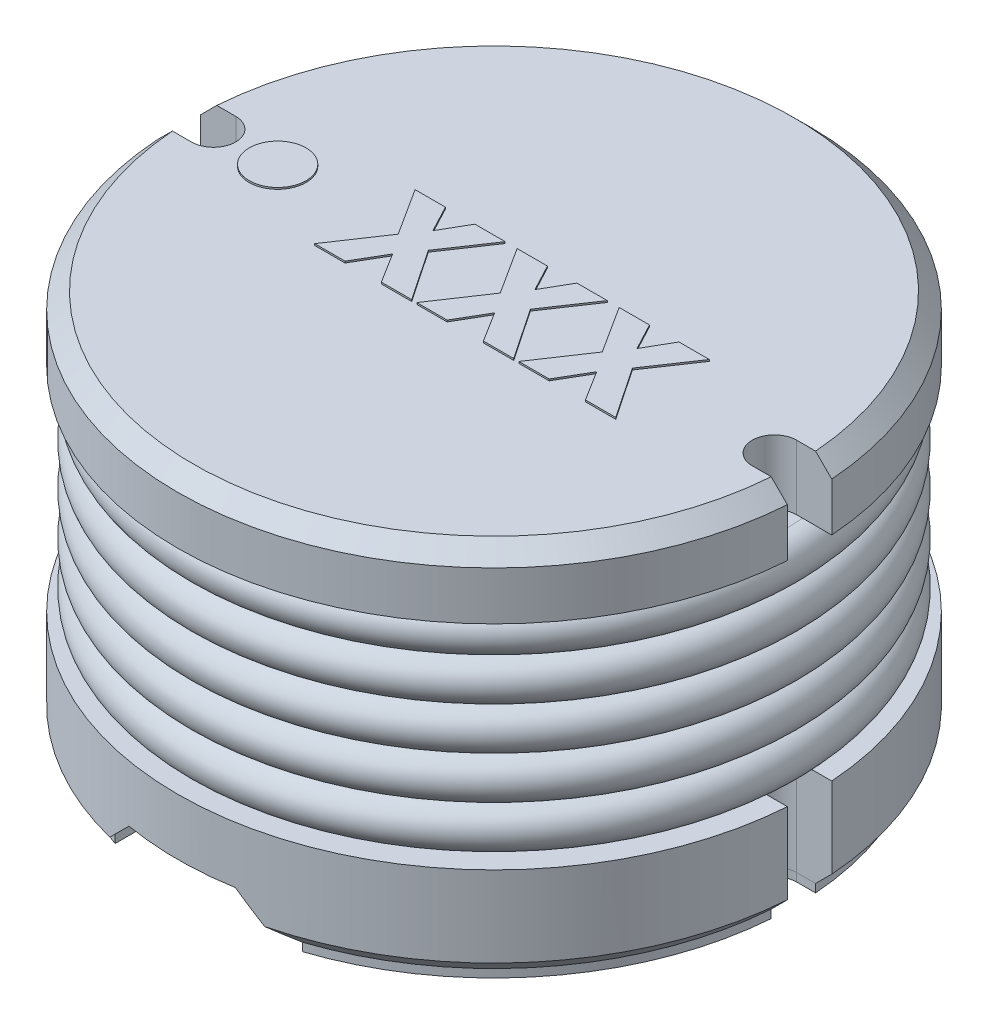
from build123d import *

# Parameters (mm, degrees)
CUTEXTD_BOTTOM_NOTCH_DEPTH            = 10.036592278
CUTEXTD_BOTTOM_NOTCH_DEPTH_BACK       = 10.036592278
CUTEXTD_TOP_BOT_WIRE_PASSTHRUS_DEPTH  = 10.036592278
EXTDBOSS_ELECTRODES_ON_BOTTOM_DEPTH   = 0.127
EXTDBOSS_ELECTRODES_ON_BOTTOM_2_DEPTH = 0.127
SKETCH6_R                             = 0.440109776
BOSSEXTD_LABEL_TOP_DEPTH              = 0.0254
BOSSEXTD_LABEL_TOP_2_DEPTH            = 0.0254
BOSSEXTD_LABEL_TOP_3_DEPTH            = 0.0254
BOSSEXTD_LABEL_TOP_4_DEPTH            = 0.0254


with BuildPart() as part:
    # Sketch1 → Revolve: Main Core Shape (revolve)
    with BuildSketch(Plane.XY, mode=Mode.PRIVATE) as revolve_main_core_shape_sk:
        Polygon((0, 0), (4.65, 0), (4.9, 0.25), (4.9, 1.5), (4, 1.5), (4, 4.8), (4.9, 4.8), (4.9, 5.55), (4.65, 5.8), (0, 5.8), align=None)
    revolve(revolve_main_core_shape_sk.sketch.rotate(Axis((0, -9.075341638, 0), (0, 1, 0)), 90), axis=Axis((0, -9.075341638, 0), (0, 1, 0)))

    # Sketch2 → CutExtd: Bottom Notch (cut, two sides: drawn at the far end of the back side and taken through both)
    with BuildSketch(Plane.XY.offset(-CUTEXTD_BOTTOM_NOTCH_DEPTH_BACK)):
        Polygon((-1.45, 0), (-0.825, 0.625), (0.825, 0.625), (1.45, 0), align=None)
    extrude(amount=CUTEXTD_BOTTOM_NOTCH_DEPTH + CUTEXTD_BOTTOM_NOTCH_DEPTH_BACK, mode=Mode.SUBTRACT)

    # Sketch3 → CutExtd: Top/Bot Wire PassThrus (cut, through all)
    with BuildSketch(Plane(origin=(0, 0, 0), x_dir=(1, 0, 0), z_dir=(0, 1, 0))):
        with BuildLine():
            Line((-5.456343832, 0.343656168), (-4.343656168, 0.343656168))
            ThreePointArc((-4.343656168, 0.343656168), (-4, 0), (-4.343656168, -0.343656168))
            Line((-4.343656168, -0.343656168), (-5.456343832, -0.343656168))
            ThreePointArc((-5.456343832, -0.343656168), (-5.8, 0), (-5.456343832, 0.343656168))
        make_face()
        with BuildLine():
            Line((5.456343832, -0.343656168), (4.343656168, -0.343656168))
            ThreePointArc((4.343656168, -0.343656168), (4, 0), (4.343656168, 0.343656168))
            Line((4.343656168, 0.343656168), (5.456343832, 0.343656168))
            ThreePointArc((5.456343832, 0.343656168), (5.8, 0), (5.456343832, -0.343656168))
        make_face()
    extrude(amount=CUTEXTD_TOP_BOT_WIRE_PASSTHRUS_DEPTH, mode=Mode.SUBTRACT)

    # Sketch5 → Revolve: Coil (revolve)
    with BuildSketch(Plane(origin=(0, 0, 0), x_dir=(0, 0, -1), z_dir=(1, 0, 0))):
        with BuildLine():
            Line((4, 4.8), (4, 1.5))
            Line((4, 1.5), (4.449424703, 1.5))
            ThreePointArc((4.449424703, 1.5), (4.779424703, 1.83), (4.449424703, 2.16))
            ThreePointArc((4.449424703, 2.16), (4.779424703, 2.49), (4.449424703, 2.82))
            ThreePointArc((4.449424703, 2.82), (4.779424703, 3.15), (4.449424703, 3.48))
            ThreePointArc((4.449424703, 3.48), (4.779424703, 3.81), (4.449424703, 4.14))
            ThreePointArc((4.449424703, 4.14), (4.779424703, 4.47), (4.449424703, 4.8))
            Line((4.449424703, 4.8), (4, 4.8))
        make_face()
    revolve(axis=Axis((0, 0, 0), (0, 1, 0)))


with BuildPart() as body_2:
    # Sketch4 → ExtdBoss: Electrodes on Bottom (new body)
    with BuildSketch(Plane(origin=(0, 0, 0), x_dir=(1, 0, 0), z_dir=(0, 1, 0))):
        with BuildLine():
            Line((-1.45, -4.418144407), (-1.45, 4.418144407))
            ThreePointArc((-1.45, 4.418144407), (-3.662529101, 2.865027152), (-4.637283735, 0.343656168))
            Line((-4.637283735, 0.343656168), (-4.343656168, 0.343656168))
            ThreePointArc((-4.343656168, 0.343656168), (-4, 0), (-4.343656168, -0.343656168))
            Line((-4.343656168, -0.343656168), (-4.637283735, -0.343656168))
            ThreePointArc((-4.637283735, -0.343656168), (-3.662529101, -2.865027152), (-1.45, -4.418144407))
        make_face()
    extrude(amount=-EXTDBOSS_ELECTRODES_ON_BOTTOM_DEPTH)


with BuildPart() as body_3:
    # Sketch4 → ExtdBoss_ Electrodes on Bottom 2 (new body)
    with BuildSketch(Plane(origin=(0, 0, 0), x_dir=(1, 0, 0), z_dir=(0, 1, 0))):
        with BuildLine():
            Line((4.343656168, -0.343656168), (4.637283735, -0.343656168))
            ThreePointArc((4.637283735, -0.343656168), (3.662529101, -2.865027152), (1.45, -4.418144407))
            Line((1.45, -4.418144407), (1.45, 4.418144407))
            ThreePointArc((1.45, 4.418144407), (3.662529101, 2.865027152), (4.637283735, 0.343656168))
            Line((4.637283735, 0.343656168), (4.343656168, 0.343656168))
            ThreePointArc((4.343656168, 0.343656168), (4, 0), (4.343656168, -0.343656168))
        make_face()
    extrude(amount=-EXTDBOSS_ELECTRODES_ON_BOTTOM_2_DEPTH)


with BuildPart() as body_4:
    # Sketch6 → BossExtd: Label (Top) (new body)
    with BuildSketch(Plane(origin=(0, 5.8, 0), x_dir=(1, 0, 0), z_dir=(0, 1, 0))):
        with Locations(Location((-3.351170639, 0, 0), (0, 0, 270))):
            Circle(SKETCH6_R)
    extrude(amount=BOSSEXTD_LABEL_TOP_DEPTH)


with BuildPart() as body_5:
    # Sketch6 → BossExtd_ Label _Top 2 (new body)
    with BuildSketch(Plane(origin=(0, 5.8, 0), x_dir=(1, 0, 0), z_dir=(0, 1, 0))):
        Polygon((-1.999222394, -0.777267715), (-1.480207994, -0.003890983), (-1.946538934, 0.724210901), (-1.476915277, 0.724210901), (-1.257949646, 0.3113866), (-1.020050896, 0.724210901), (-0.550427239, 0.724210901), (-1.030340634, 0.012984188), (-0.497743779, -0.777267715), (-0.967367436, -0.777267715), (-1.257949646, -0.312171543), (-1.529598738, -0.777267715), align=None)
    extrude(amount=BOSSEXTD_LABEL_TOP_2_DEPTH)


with BuildPart() as body_6:
    # Sketch6 → BossExtd_ Label _Top 3 (new body)
    with BuildSketch(Plane(origin=(0, 5.8, 0), x_dir=(1, 0, 0), z_dir=(0, 1, 0))):
        Polygon((-0.418718588, -0.777267715), (0.100295813, -0.003890983), (-0.366035128, 0.724210901), (0.103588529, 0.724210901), (0.32255416, 0.3113866), (0.56045291, 0.724210901), (1.030076567, 0.724210901), (0.550163172, 0.012984188), (1.082760027, -0.777267715), (0.61313637, -0.777267715), (0.32255416, -0.312171543), (0.050905069, -0.777267715), align=None)
    extrude(amount=BOSSEXTD_LABEL_TOP_3_DEPTH)


with BuildPart() as body_7:
    # Sketch6 → BossExtd_ Label _Top 4 (new body)
    with BuildSketch(Plane(origin=(0, 5.8, 0), x_dir=(1, 0, 0), z_dir=(0, 1, 0))):
        Polygon((1.161785218, -0.777267715), (1.680799619, -0.003890983), (1.214468678, 0.724210901), (1.684092335, 0.724210901), (1.903057966, 0.3113866), (2.140956716, 0.724210901), (2.610580373, 0.724210901), (2.130666978, 0.012984188), (2.663263833, -0.777267715), (2.193640177, -0.777267715), (1.903057966, -0.312171543), (1.631408875, -0.777267715), align=None)
    extrude(amount=BOSSEXTD_LABEL_TOP_4_DEPTH)


solid = Compound([part.part, body_2.part, body_3.part, body_4.part, body_5.part, body_6.part, body_7.part])
